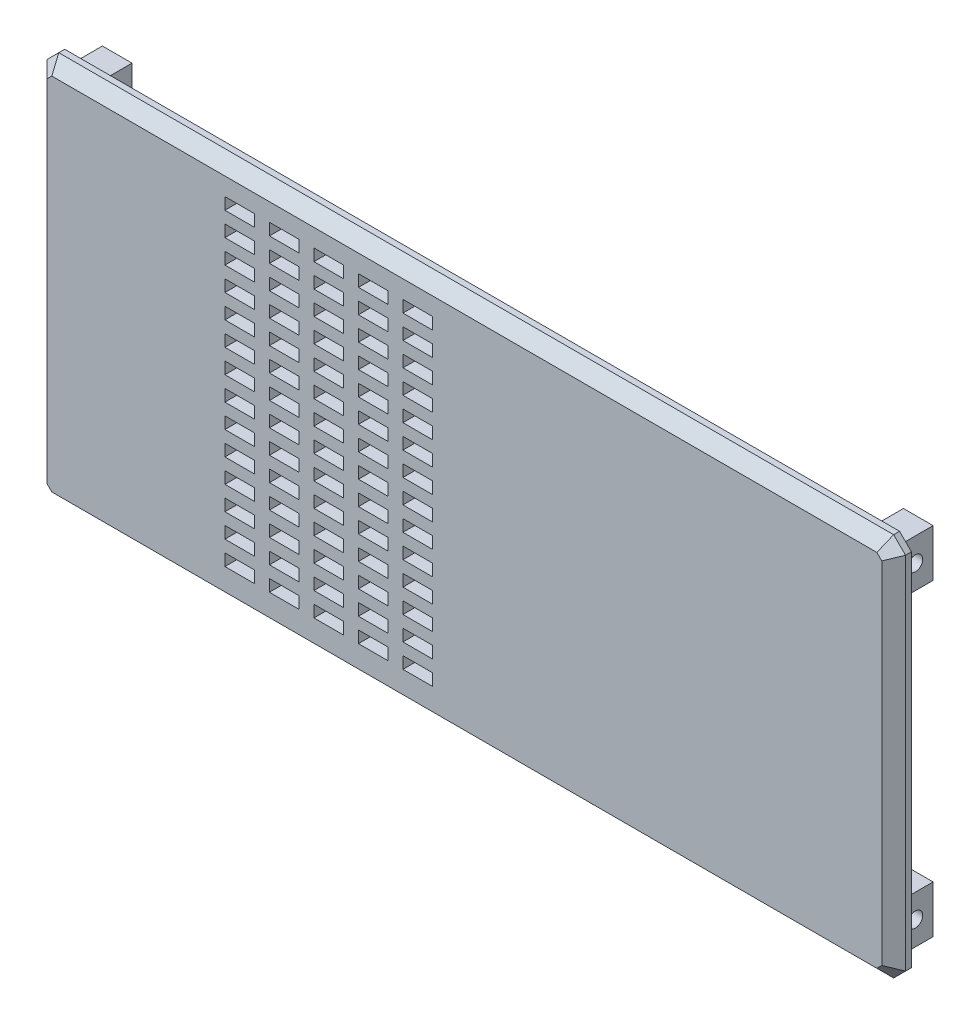
from build123d import *

# Parameters (mm, degrees)
EXTRUDE_1_DEPTH     = 3
SKETCH_2_W          = 140
SKETCH_2_H          = 60
SKETCH_2_W_2        = 136
SKETCH_2_H_2        = 56
EXTRUDE_2_DEPTH     = 2
SKETCH_3_W          = 5
SKETCH_3_H          = 8
EXTRUDE_3_DEPTH     = 6
CUT_EXTRUDE_START   = -140
SKETCH_4_R          = 1.25
CUT_EXTRUDE_1_DEPTH = 140
SKETCH_6_W          = 5
SKETCH_6_H          = 2
CUT_EXTRUDE_2_DEPTH = 3
CHAMFER_1_SIZE      = 2


with BuildPart() as part:
    # Эскиз1 → Бобышка-Вытянуть1 (new body)
    with BuildSketch(Plane.XY):
        Polygon((-72.35, 30.35), (-70.35, 32.35), (70.35, 32.35), (72.35, 30.35), (72.35, -30.35), (70.35, -32.35), (-70.35, -32.35), (-72.35, -30.35), align=None)
    extrude(amount=EXTRUDE_1_DEPTH)

    # Эскиз2 → Бобышка-Вытянуть2 (add)
    with BuildSketch(Plane(origin=(0, 0, 0), x_dir=(-1, 0, 0), z_dir=(0, 0, -1))):
        Rectangle(SKETCH_2_W, SKETCH_2_H)
        Rectangle(SKETCH_2_W_2, SKETCH_2_H_2, mode=Mode.SUBTRACT)
    extrude(amount=EXTRUDE_2_DEPTH)

    # Эскиз3 → Бобышка-Вытянуть3 (add)
    with BuildSketch(Plane(origin=(0, 0, 0), x_dir=(-1, 0, 0), z_dir=(0, 0, -1))):
        with Locations((-67.5, 26)):
            Rectangle(SKETCH_3_W, SKETCH_3_H)
        with Locations((-67.5, -26)):
            Rectangle(SKETCH_3_W, SKETCH_3_H)
        with Locations((67.5, -26)):
            Rectangle(SKETCH_3_W, SKETCH_3_H)
        with Locations((67.5, 26)):
            Rectangle(SKETCH_3_W, SKETCH_3_H)
    extrude(amount=EXTRUDE_3_DEPTH)

    # Эскиз4 → Вырез-Вытянуть1 (cut)
    with BuildSketch(Plane(origin=(70, 0, 0), x_dir=(0, 0, -1), z_dir=(1, 0, 0)).offset(CUT_EXTRUDE_START)):
        with Locations((3, 26)):
            Circle(SKETCH_4_R)
        with Locations((3, -26)):
            Circle(SKETCH_4_R)
    extrude(amount=CUT_EXTRUDE_1_DEPTH, mode=Mode.SUBTRACT)

    # Эскиз6 → Вырез-Вытянуть2 (cut)
    with BuildSketch(Plane.XY.offset(3)):
        with Locations((-30.35, 26.35)):
            Rectangle(SKETCH_6_W, SKETCH_6_H)
        with Locations((-37.85, 26.35)):
            Rectangle(SKETCH_6_W, SKETCH_6_H)
        with Locations((-22.85, 26.35)):
            Rectangle(SKETCH_6_W, SKETCH_6_H)
        with Locations((-15.35, 26.35)):
            Rectangle(SKETCH_6_W, SKETCH_6_H)
        with Locations((-7.85, 26.35)):
            Rectangle(SKETCH_6_W, SKETCH_6_H)
        with Locations((-30.35, 22.35)):
            Rectangle(SKETCH_6_W, SKETCH_6_H)
        with Locations((-22.85, 22.35)):
            Rectangle(SKETCH_6_W, SKETCH_6_H)
        with Locations((-15.35, 22.35)):
            Rectangle(SKETCH_6_W, SKETCH_6_H)
        with Locations((-7.85, 22.35)):
            Rectangle(SKETCH_6_W, SKETCH_6_H)
        with Locations((-30.35, 18.35)):
            Rectangle(SKETCH_6_W, SKETCH_6_H)
        with Locations((-22.85, 18.35)):
            Rectangle(SKETCH_6_W, SKETCH_6_H)
        with Locations((-15.35, 18.35)):
            Rectangle(SKETCH_6_W, SKETCH_6_H)
        with Locations((-7.85, 18.35)):
            Rectangle(SKETCH_6_W, SKETCH_6_H)
        with Locations((-30.35, 14.35)):
            Rectangle(SKETCH_6_W, SKETCH_6_H)
        with Locations((-22.85, 14.35)):
            Rectangle(SKETCH_6_W, SKETCH_6_H)
        with Locations((-15.35, 14.35)):
            Rectangle(SKETCH_6_W, SKETCH_6_H)
        with Locations((-7.85, 14.35)):
            Rectangle(SKETCH_6_W, SKETCH_6_H)
        with Locations((-30.35, 10.35)):
            Rectangle(SKETCH_6_W, SKETCH_6_H)
        with Locations((-22.85, 10.35)):
            Rectangle(SKETCH_6_W, SKETCH_6_H)
        with Locations((-15.35, 10.35)):
            Rectangle(SKETCH_6_W, SKETCH_6_H)
        with Locations((-7.85, 10.35)):
            Rectangle(SKETCH_6_W, SKETCH_6_H)
        with Locations((-30.35, 6.35)):
            Rectangle(SKETCH_6_W, SKETCH_6_H)
        with Locations((-22.85, 6.35)):
            Rectangle(SKETCH_6_W, SKETCH_6_H)
        with Locations((-15.35, 6.35)):
            Rectangle(SKETCH_6_W, SKETCH_6_H)
        with Locations((-7.85, 6.35)):
            Rectangle(SKETCH_6_W, SKETCH_6_H)
        with Locations((-30.35, 2.35)):
            Rectangle(SKETCH_6_W, SKETCH_6_H)
        with Locations((-22.85, 2.35)):
            Rectangle(SKETCH_6_W, SKETCH_6_H)
        with Locations((-15.35, 2.35)):
            Rectangle(SKETCH_6_W, SKETCH_6_H)
        with Locations((-7.85, 2.35)):
            Rectangle(SKETCH_6_W, SKETCH_6_H)
        with Locations((-30.35, -1.65)):
            Rectangle(SKETCH_6_W, SKETCH_6_H)
        with Locations((-22.85, -1.65)):
            Rectangle(SKETCH_6_W, SKETCH_6_H)
        with Locations((-15.35, -1.65)):
            Rectangle(SKETCH_6_W, SKETCH_6_H)
        with Locations((-7.85, -1.65)):
            Rectangle(SKETCH_6_W, SKETCH_6_H)
        with Locations((-30.35, -5.65)):
            Rectangle(SKETCH_6_W, SKETCH_6_H)
        with Locations((-22.85, -5.65)):
            Rectangle(SKETCH_6_W, SKETCH_6_H)
        with Locations((-15.35, -5.65)):
            Rectangle(SKETCH_6_W, SKETCH_6_H)
        with Locations((-7.85, -5.65)):
            Rectangle(SKETCH_6_W, SKETCH_6_H)
        with Locations((-30.35, -9.65)):
            Rectangle(SKETCH_6_W, SKETCH_6_H)
        with Locations((-22.85, -9.65)):
            Rectangle(SKETCH_6_W, SKETCH_6_H)
        with Locations((-15.35, -9.65)):
            Rectangle(SKETCH_6_W, SKETCH_6_H)
        with Locations((-7.85, -9.65)):
            Rectangle(SKETCH_6_W, SKETCH_6_H)
        with Locations((-30.35, -13.65)):
            Rectangle(SKETCH_6_W, SKETCH_6_H)
        with Locations((-22.85, -13.65)):
            Rectangle(SKETCH_6_W, SKETCH_6_H)
        with Locations((-15.35, -13.65)):
            Rectangle(SKETCH_6_W, SKETCH_6_H)
        with Locations((-7.85, -13.65)):
            Rectangle(SKETCH_6_W, SKETCH_6_H)
        with Locations((-30.35, -17.65)):
            Rectangle(SKETCH_6_W, SKETCH_6_H)
        with Locations((-22.85, -17.65)):
            Rectangle(SKETCH_6_W, SKETCH_6_H)
        with Locations((-15.35, -17.65)):
            Rectangle(SKETCH_6_W, SKETCH_6_H)
        with Locations((-7.85, -17.65)):
            Rectangle(SKETCH_6_W, SKETCH_6_H)
        with Locations((-30.35, -21.65)):
            Rectangle(SKETCH_6_W, SKETCH_6_H)
        with Locations((-22.85, -21.65)):
            Rectangle(SKETCH_6_W, SKETCH_6_H)
        with Locations((-15.35, -21.65)):
            Rectangle(SKETCH_6_W, SKETCH_6_H)
        with Locations((-7.85, -21.65)):
            Rectangle(SKETCH_6_W, SKETCH_6_H)
        with Locations((-30.35, -25.65)):
            Rectangle(SKETCH_6_W, SKETCH_6_H)
        with Locations((-22.85, -25.65)):
            Rectangle(SKETCH_6_W, SKETCH_6_H)
        with Locations((-15.35, -25.65)):
            Rectangle(SKETCH_6_W, SKETCH_6_H)
        with Locations((-7.85, -25.65)):
            Rectangle(SKETCH_6_W, SKETCH_6_H)
        with Locations((-37.85, 22.35)):
            Rectangle(SKETCH_6_W, SKETCH_6_H)
        with Locations((-37.85, 18.35)):
            Rectangle(SKETCH_6_W, SKETCH_6_H)
        with Locations((-37.85, 14.35)):
            Rectangle(SKETCH_6_W, SKETCH_6_H)
        with Locations((-37.85, 10.35)):
            Rectangle(SKETCH_6_W, SKETCH_6_H)
        with Locations((-37.85, 6.35)):
            Rectangle(SKETCH_6_W, SKETCH_6_H)
        with Locations((-37.85, 2.35)):
            Rectangle(SKETCH_6_W, SKETCH_6_H)
        with Locations((-37.85, -1.65)):
            Rectangle(SKETCH_6_W, SKETCH_6_H)
        with Locations((-37.85, -5.65)):
            Rectangle(SKETCH_6_W, SKETCH_6_H)
        with Locations((-37.85, -9.65)):
            Rectangle(SKETCH_6_W, SKETCH_6_H)
        with Locations((-37.85, -13.65)):
            Rectangle(SKETCH_6_W, SKETCH_6_H)
        with Locations((-37.85, -17.65)):
            Rectangle(SKETCH_6_W, SKETCH_6_H)
        with Locations((-37.85, -21.65)):
            Rectangle(SKETCH_6_W, SKETCH_6_H)
        with Locations((-37.85, -25.65)):
            Rectangle(SKETCH_6_W, SKETCH_6_H)
    extrude(amount=-CUT_EXTRUDE_2_DEPTH, mode=Mode.SUBTRACT)

    # Фаска1
    chamfer_1_edges = [part.edges().sort_by_distance(p)[0] for p in [
        (-71.35, 31.35, 3),
        (-72.35, 0, 3),
        (-71.35, -31.35, 3),
        (0, -32.35, 3),
        (71.35, -31.35, 3),
        (72.35, 0, 3),
        (71.35, 31.35, 3),
        (0, 32.35, 3),
    ]]
    chamfer(chamfer_1_edges, length=CHAMFER_1_SIZE)


solid = part.part
